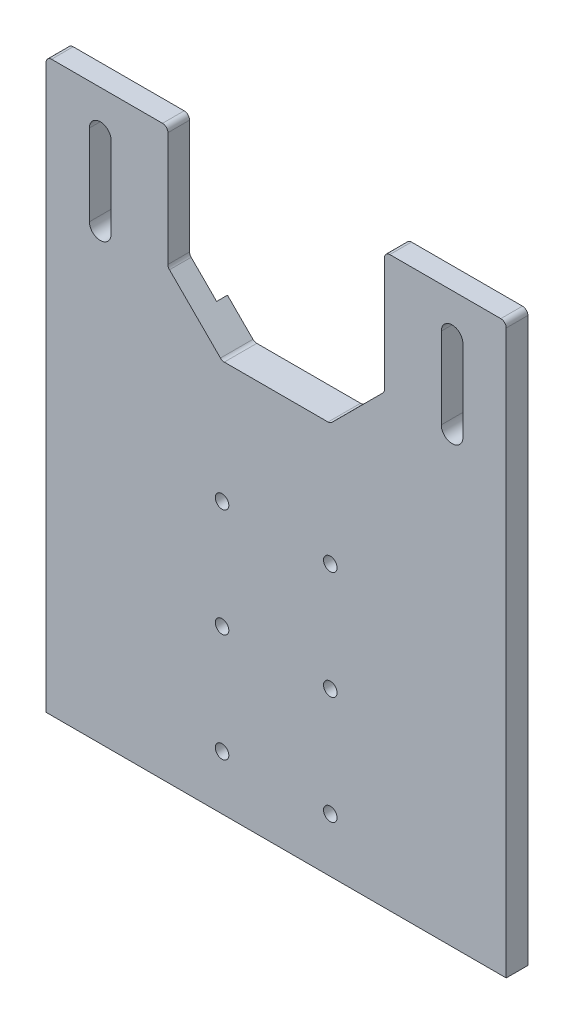
from build123d import *

# Parameters (mm, degrees)
SKETCH1_R           = 2.5
BOSS_EXTRUDE1_DEPTH = 12
SKETCH3_W           = 55
SKETCH3_H           = 210
CUT_EXTRUDE1_DEPTH  = 4
FILLET1_R           = 2


with BuildPart() as part:
    # Sketch1 → Boss-Extrude1 (new body)
    with BuildSketch(Plane.XY):
        Polygon((0, 210), (45, 210), (45, 165), (65, 145), (105, 145), (125, 165), (125, 210), (170, 210), (170, 0), (0, 0), align=None)
        with Locations((65, 20)):
            Circle(SKETCH1_R, mode=Mode.SUBTRACT)
        with Locations((65, 60)):
            Circle(SKETCH1_R, mode=Mode.SUBTRACT)
        with Locations((65, 100)):
            Circle(SKETCH1_R, mode=Mode.SUBTRACT)
        with Locations(Location((105, 100, 0), (0, 0, 180))):
            Circle(SKETCH1_R, mode=Mode.SUBTRACT)
        with Locations(Location((105, 60, 0), (0, 0, 180))):
            Circle(SKETCH1_R, mode=Mode.SUBTRACT)
        with Locations(Location((105, 20, 0), (0, 0, 180))):
            Circle(SKETCH1_R, mode=Mode.SUBTRACT)
        with BuildLine():
            Line((154, 195), (154, 165))
            ThreePointArc((154, 165), (150, 161), (146, 165))
            Line((146, 165), (146, 195))
            ThreePointArc((146, 195), (150, 199), (154, 195))
        make_face(mode=Mode.SUBTRACT)
        with BuildLine():
            Line((16, 195), (16, 165))
            ThreePointArc((16, 165), (20, 161), (24, 165))
            Line((24, 165), (24, 195))
            ThreePointArc((24, 195), (20, 199), (16, 195))
        make_face(mode=Mode.SUBTRACT)
    extrude(amount=BOSS_EXTRUDE1_DEPTH)

    # Sketch3 → Cut-Extrude1 (cut)
    with BuildSketch(Plane(origin=(0, 0, 0), x_dir=(-1, 0, 0), z_dir=(0, 0, -1))):
        with Locations((-27.5, 105)):
            Rectangle(SKETCH3_W, SKETCH3_H)
        with Locations((-142.5, 105)):
            Rectangle(SKETCH3_W, SKETCH3_H)
    extrude(amount=-CUT_EXTRUDE1_DEPTH, mode=Mode.SUBTRACT)

    # Fillet1
    fillet1_edges = [part.edges().sort_by_distance(p)[0] for p in [
        (0, 210, 8),
        (45, 210, 8),
        (45, 165, 8),
        (65, 145, 6),
        (105, 145, 6),
        (125, 165, 8),
        (125, 210, 8),
        (170, 210, 8),
    ]]
    fillet(fillet1_edges, radius=FILLET1_R)


solid = part.part
